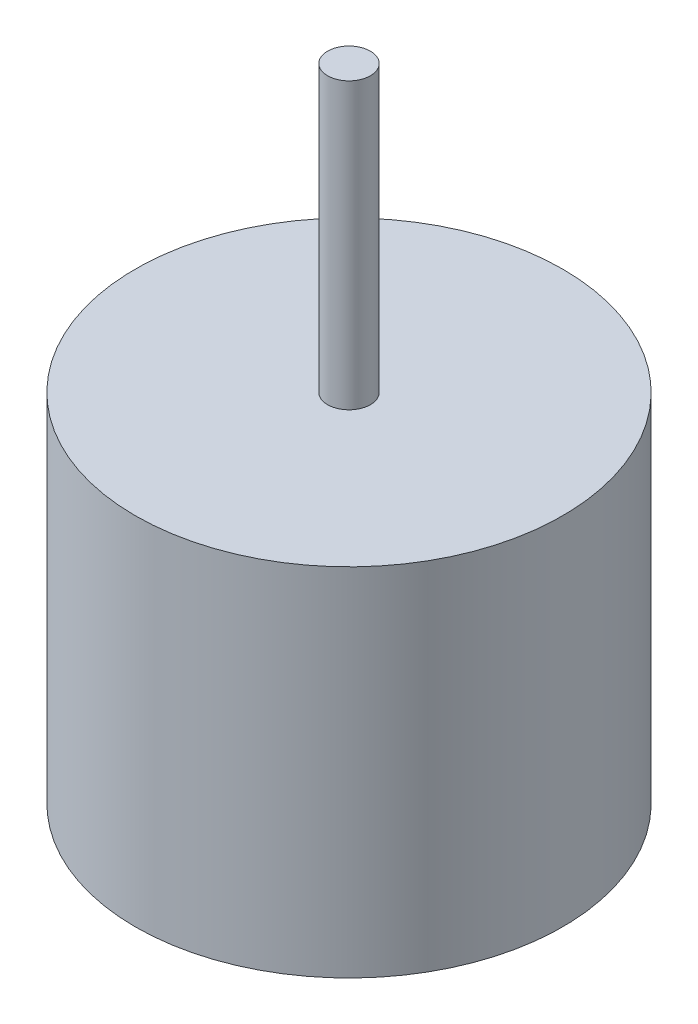
from build123d import *

# Parameters (mm, degrees)
ESBO_O1_R                     = 15
ESBO_O1_R_2                   = 1.5
RESSALTO_EXTRUS_O1_DEPTH      = 25
RESSALTO_EXTRUS_O2_DEPTH      = 20
RESSALTO_EXTRUS_O2_DEPTH_BACK = 25
ESBO_O4_R                     = 1.5


with BuildPart() as part:
    # Esboço1 → Ressalto-extrusão1 (new body)
    with BuildSketch(Plane(origin=(0, 0, 0), x_dir=(1, 0, 0), z_dir=(0, 1, 0))):
        with Locations(Location((0, 0, 0), (0, 0, 270))):
            Circle(ESBO_O1_R)
        with Locations(Location((0, 0, 0), (0, 0, 270))):
            Circle(ESBO_O1_R_2, mode=Mode.SUBTRACT)
    extrude(amount=RESSALTO_EXTRUS_O1_DEPTH)

    # Esboço4 → Ressalto-extrusão2 (add, two sides: drawn at the far end of the back side and taken through both)
    with BuildSketch(Plane(origin=(0, 25, 0), x_dir=(1, 0, 0), z_dir=(0, 1, 0)).offset(-RESSALTO_EXTRUS_O2_DEPTH_BACK)):
        with Locations(Location((0, 0, 0), (0, 0, 270))):
            Circle(ESBO_O4_R)
    extrude(amount=RESSALTO_EXTRUS_O2_DEPTH + RESSALTO_EXTRUS_O2_DEPTH_BACK)


solid = part.part
